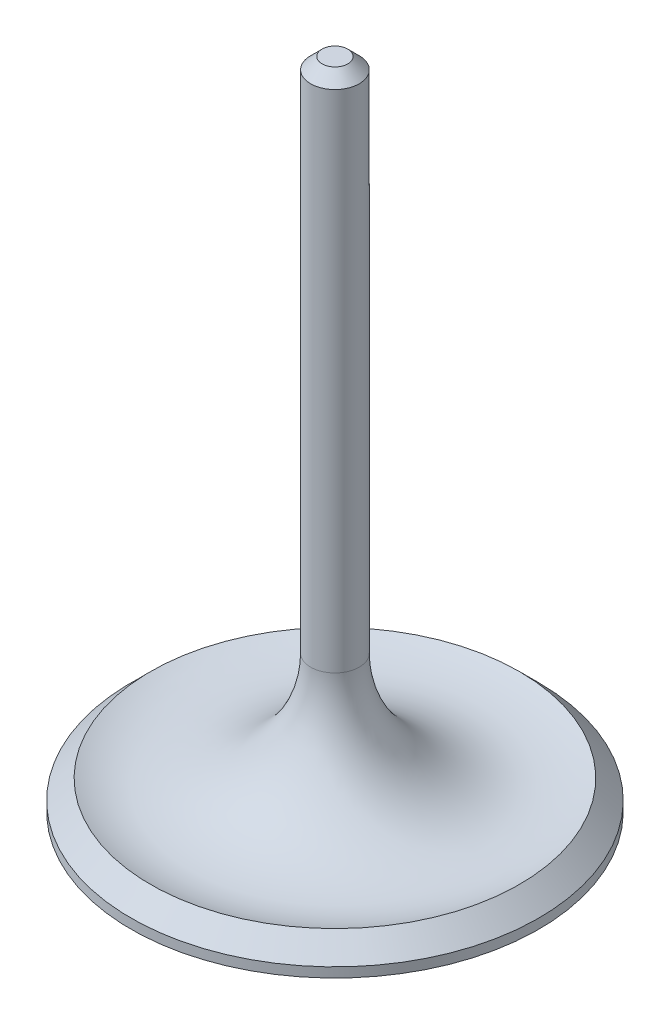
from build123d import *

# Parameters (mm, degrees)
CHAMFER1_SIZE = 1.5


with BuildPart() as part:
    # Sketch1 → Revolve1 (revolve)
    with BuildSketch(Plane.XY, mode=Mode.PRIVATE) as revolve1_sk:
        with BuildLine():
            Line((0, 0), (0, 85.55))
            Line((0, 85.55), (3.18, 85.55))
            Line((3.18, 85.55), (3.18, 17.954698654))
            ThreePointArc((3.18, 17.954698654), (9.896609701, 5.315721242), (24.13, 3.81))
            Line((24.13, 3.81), (26.67, 1.27))
            Line((26.67, 1.27), (26.67, 0))
            Line((26.67, 0), (0, 0))
        make_face()
    revolve(revolve1_sk.sketch.rotate(Axis((0, 0, 0), (0, 1, 0)), 90), axis=Axis((0, 0, 0), (0, 1, 0)))

    # Chamfer1
    chamfer1_edges = [part.edges().sort_by_distance(p)[0] for p in [
        (0, 85.55, 3.18),
    ]]
    chamfer(chamfer1_edges, length=CHAMFER1_SIZE)


solid = part.part
